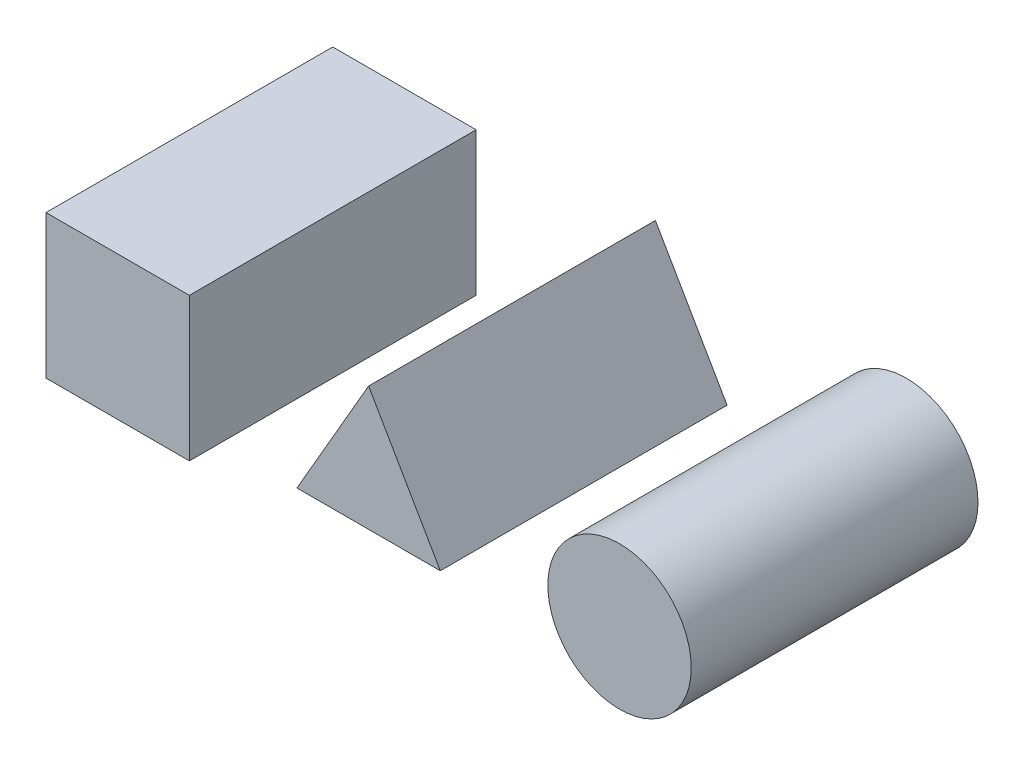
from build123d import *

# Parameters (mm, degrees)
SKETCH1_R             = 20
BOSS_EXTRUDE1_DEPTH   = 80
BOSS_EXTRUDE1_2_DEPTH = 80
SKETCH1_W             = 40
SKETCH1_H             = 40
BOSS_EXTRUDE1_3_DEPTH = 80


with BuildPart() as part:
    # Sketch1 → Boss-Extrude1 (new body)
    with BuildSketch(Plane.XY):
        with Locations((70, 0)):
            Circle(SKETCH1_R)
    extrude(amount=BOSS_EXTRUDE1_DEPTH)


with BuildPart() as body_2:
    # Sketch1 → Boss-Extrude1 2 (new body)
    with BuildSketch(Plane.XY):
        Polygon((-20, -11.547005384), (0, 23.094010768), (20, -11.547005384), align=None)
    extrude(amount=BOSS_EXTRUDE1_2_DEPTH)


with BuildPart() as body_3:
    # Sketch1 → Boss-Extrude1 3 (new body)
    with BuildSketch(Plane.XY):
        with Locations((-70, 0)):
            Rectangle(SKETCH1_W, SKETCH1_H)
    extrude(amount=BOSS_EXTRUDE1_3_DEPTH)


solid = Compound([part.part, body_2.part, body_3.part])
